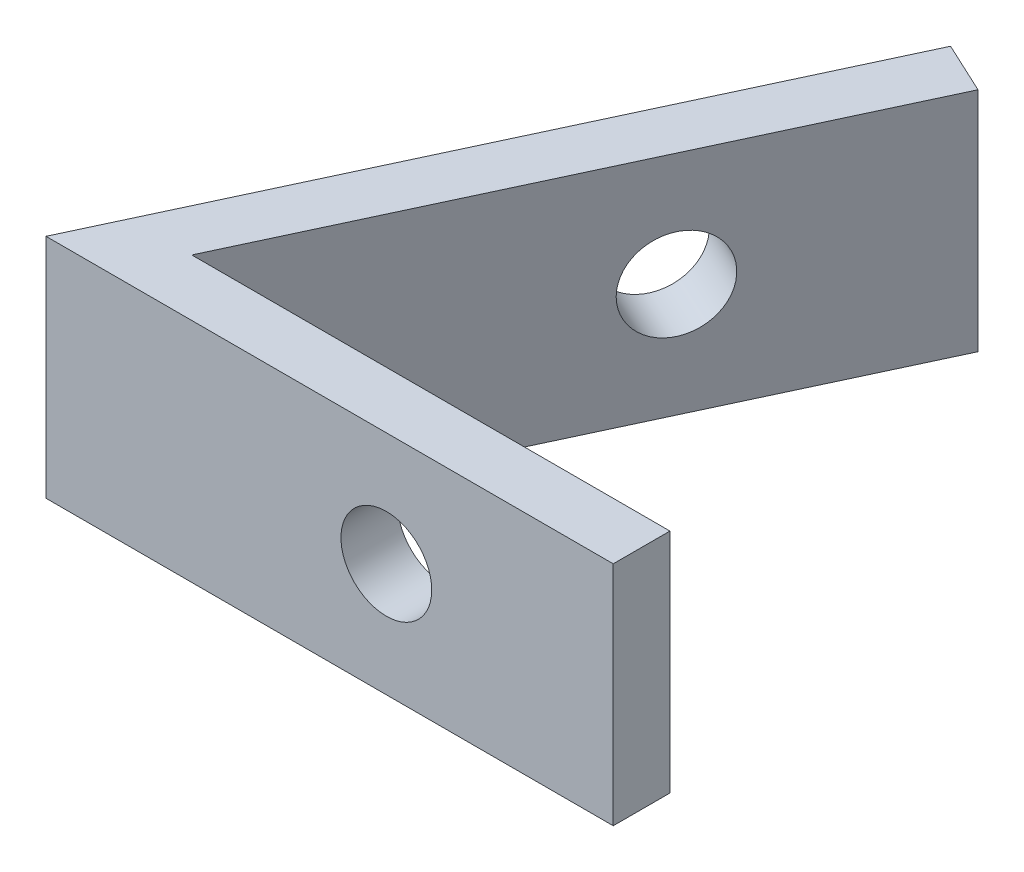
from build123d import *

# Parameters (mm, degrees)
BOSS_EXTRUDE1_DEPTH = 20
SKETCH2_R           = 4
CUT_EXTRUDE2_DEPTH  = 5
SKETCH3_R           = 4
CUT_EXTRUDE3_DEPTH  = 5


with BuildPart() as part:
    # Sketch1 → Boss-Extrude1 (new body)
    with BuildSketch(Plane(origin=(0, 0, 0), x_dir=(1, 0, 0), z_dir=(0, 1, 0))):
        Polygon((0, 0), (12.679677005, 0), (12.679677005, 5), (-29.47189511, 5), (-7.431688356, 52.265375913), (-11.963227291, 54.378467222), (-37.320322995, 0), align=None)
    extrude(amount=BOSS_EXTRUDE1_DEPTH)

    # Sketch2 → Cut-Extrude2 (cut)
    with BuildSketch(Plane(origin=(-30.654682103, 0, -14.294513023), x_dir=(-0.42261826174070366, 0, 0.906307787036648), z_dir=(-0.9063077870366479, 0, -0.4226182617407036))):
        with Locations((-24.227749968, 10)):
            Circle(SKETCH2_R)
    extrude(amount=-CUT_EXTRUDE2_DEPTH, mode=Mode.SUBTRACT)

    # Sketch3 → Cut-Extrude3 (cut)
    with BuildSketch(Plane.XY):
        with Locations((-7.320322995, 10)):
            Circle(SKETCH3_R)
    extrude(amount=-CUT_EXTRUDE3_DEPTH, mode=Mode.SUBTRACT)


solid = part.part
